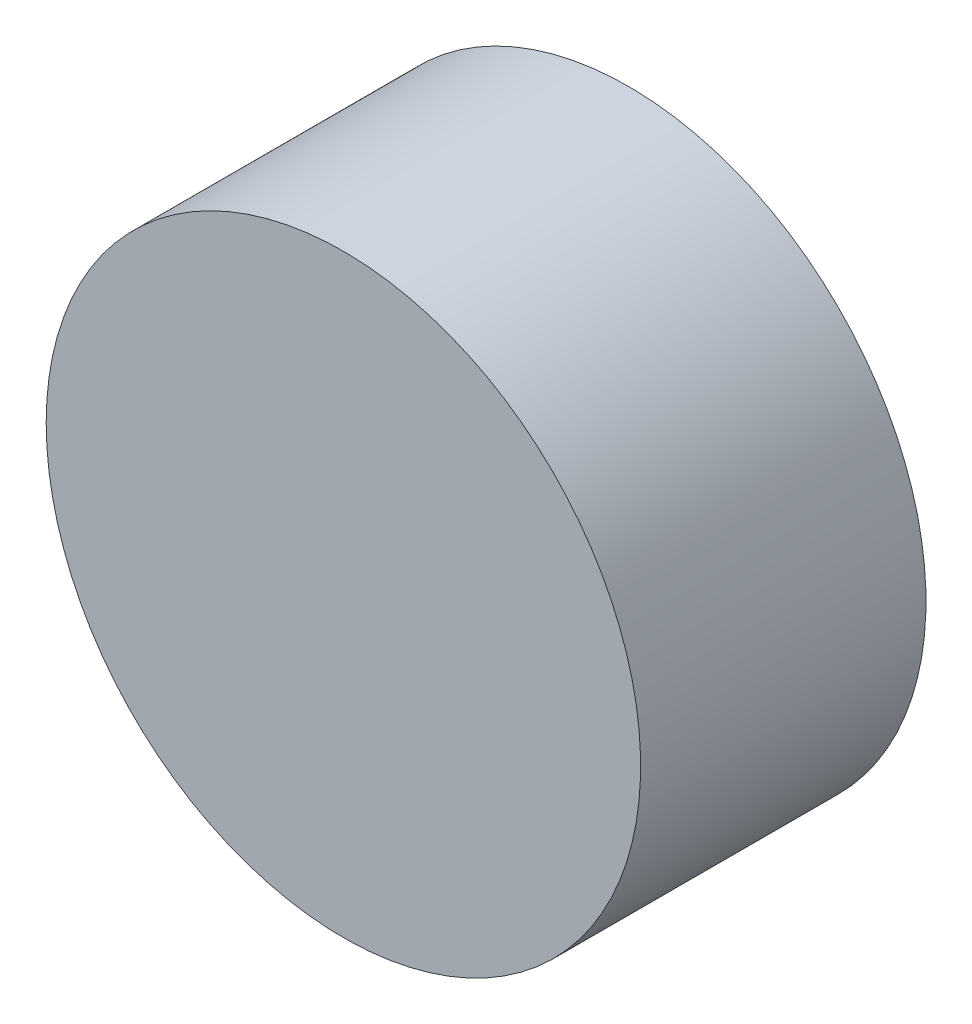
from build123d import *

# Parameters (mm, degrees)
SKETCH1_R           = 1.5875
BOSS_EXTRUDE1_DEPTH = 1.524


with BuildPart() as part:
    # Sketch1 → Boss-Extrude1 (new body)
    with BuildSketch(Plane.XY):
        with Locations(Location((0, 0, 0), (0, 0, 180))):
            Circle(SKETCH1_R)
    extrude(amount=BOSS_EXTRUDE1_DEPTH)


solid = part.part
